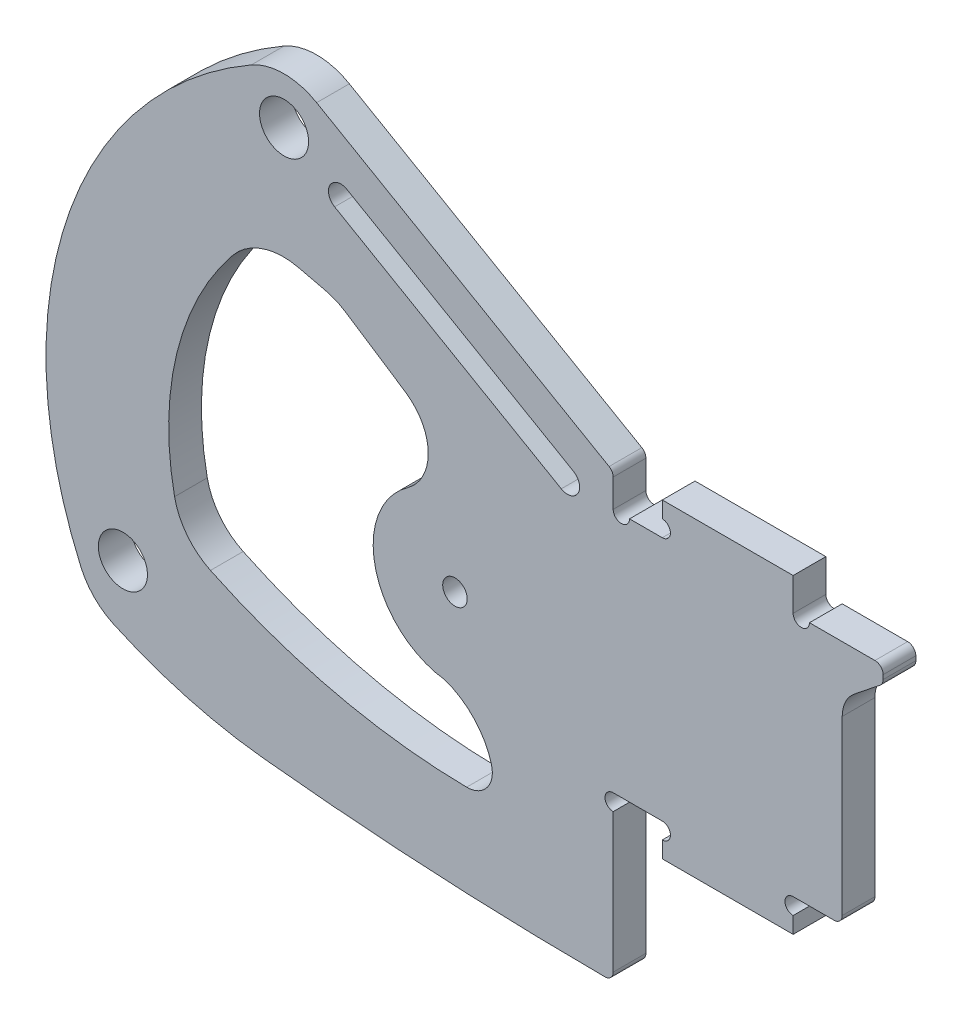
from build123d import *

# Parameters (mm, degrees)
SKETCH1_R           = 0.75
BOSS_EXTRUDE1_DEPTH = 2
FILLET7_R           = 4
FILLET8_R           = 0.5
FILLET9_R           = 2
SKETCH2_R           = 1.5
CUT_EXTRUDE1_DEPTH  = 46.472229495
FILLET10_R          = 4
FILLET12_R          = 3


with BuildPart() as part:
    # Sketch1 → Boss-Extrude1 (new body)
    with BuildSketch(Plane.XY):
        with BuildLine():
            ThreePointArc((9.900055809, -1), (9.400055809, -0.5), (9.900055809, 0))
            Line((9.900055809, 0), (12.900055809, 0))
            Line((12.900055809, 0), (12.900055809, 12))
            Line((12.900055809, 12), (15.400055809, 14))
            Line((15.400055809, 14), (15.400055809, 15))
            Line((15.400055809, 15), (10.898257816, 15))
            ThreePointArc((10.898257816, 15), (10.399156812, 14.500898997), (9.900055809, 15))
            Line((9.900055809, 15), (9.900055809, 17))
            Line((9.900055809, 17), (1.900055809, 17))
            Line((1.900055809, 17), (1.900055809, 16))
            ThreePointArc((1.900055809, 16), (2.400055809, 15.5), (1.900055809, 15))
            Line((1.900055809, 15), (-0.099944191, 15))
            ThreePointArc((-0.099944191, 15), (-0.599944191, 14.5), (-1.099944191, 15))
            Line((-1.099944191, 15), (-1.099944191, 17))
            Line((-1.099944191, 17), (-21.109742569, 28.55266248))
            ThreePointArc((-21.109742569, 28.55266248), (-34.392766222, 13.978204373), (-32.979517798, -5.690457894))
            ThreePointArc((-32.979517798, -5.690457894), (-27.872628368, -7.772375219), (-22.467282567, -8.866421))
            ThreePointArc((-22.467282567, -8.866421), (-11.79863746, -9.716406126), (-1.099944191, -10))
            Line((-1.099944191, -10), (-1.099944191, -1))
            ThreePointArc((-1.099944191, -1), (-1.599944191, -0.5), (-1.099944191, 0))
            Line((-1.099944191, 0), (1.900055809, 0))
            ThreePointArc((1.900055809, 0), (2.400055809, -0.5), (1.900055809, -1))
            Line((1.900055809, -1), (1.900055809, -2))
            Line((1.900055809, -2), (9.900055809, -2))
            Line((9.900055809, -2), (9.900055809, -1))
        make_face()
        with Locations((-10.771610825, 5.790346428)):
            Circle(SKETCH1_R, mode=Mode.SUBTRACT)
    extrude(amount=BOSS_EXTRUDE1_DEPTH)

    # Fillet7
    fillet7_edges = [part.edges().sort_by_distance(p)[0] for p in [
        (-32.979517798, -5.690457894, 1),
        (-21.109742569, 28.55266248, 1),
    ]]
    fillet(fillet7_edges, radius=FILLET7_R)

    # Fillet8
    fillet8_edges = [part.edges().sort_by_distance(p)[0] for p in [
        (-1.099944191, 17, 1),
        (15.400055809, 15, 1),
        (15.400055809, 14, 1),
        (12.900055809, 0, 1),
        (-1.099944191, -10, 1),
    ]]
    fillet(fillet8_edges, radius=FILLET8_R)

    # Fillet9
    fillet9_edges = [part.edges().sort_by_distance(p)[0] for p in [
        (12.900055809, 12, 1),
    ]]
    fillet(fillet9_edges, radius=FILLET9_R)

    # Sketch2 → Cut-Extrude1 (cut, through all)
    with BuildSketch(Plane.XY.offset(2)):
        with Locations((-21.218823002, 25.151538482)):
            Circle(SKETCH2_R)
        with Locations((-31.071264961, -2.690457894)):
            Circle(SKETCH2_R)
        with BuildLine():
            Line((-18.019584713, 17.636691368), (-22.57366805, 18.711702598))
            ThreePointArc((-22.57366805, 18.711702598), (-27.700823696, 10.223376044), (-27.391868807, 0.311566946))
            ThreePointArc((-27.391868807, 0.311566946), (-18.997839896, -2.988434266), (-10.058124429, -4.184768964))
            ThreePointArc((-10.058124429, -4.184768964), (-8.812200112, -3.583264873), (-8.54147164, -2.226489037))
            ThreePointArc((-8.54147164, -2.226489037), (-9.58655744, -0.347195343), (-11.387108468, 0.828374779))
            ThreePointArc((-11.387108468, 0.828374779), (-15.771507704, 5.758234049), (-11.450792663, 10.744002859))
            Line((-11.450792663, 10.744002859), (-12.839873731, 14.232317382))
            Line((-12.839873731, 14.232317382), (-18.019584713, 17.636691368))
        make_face()
        with BuildLine():
            Line((-18.129721387, 22.502019429), (-4.273314926, 14.502019429))
            ThreePointArc((-4.273314926, 14.502019429), (-3.248795873, 14.776538482), (-3.523314926, 15.801057535))
            Line((-3.523314926, 15.801057535), (-17.379721387, 23.801057535))
            ThreePointArc((-17.379721387, 23.801057535), (-18.404240439, 23.526538482), (-18.129721387, 22.502019429))
        make_face()
    extrude(amount=-CUT_EXTRUDE1_DEPTH, mode=Mode.SUBTRACT)

    # Fillet10
    fillet10_edges = [part.edges().sort_by_distance(p)[0] for p in [
        (-27.391868807, 0.311566946, 1),
        (-22.57366805, 18.711702598, 1),
        (-18.019584713, 17.636691368, 1),
        (-12.839873731, 14.232317382, 1),
    ]]
    fillet(fillet10_edges, radius=FILLET10_R)

    # Fillet12
    fillet12_edges = [part.edges().sort_by_distance(p)[0] for p in [
        (-11.450792663, 10.744002859, 1),
    ]]
    fillet(fillet12_edges, radius=FILLET12_R)


solid = part.part
